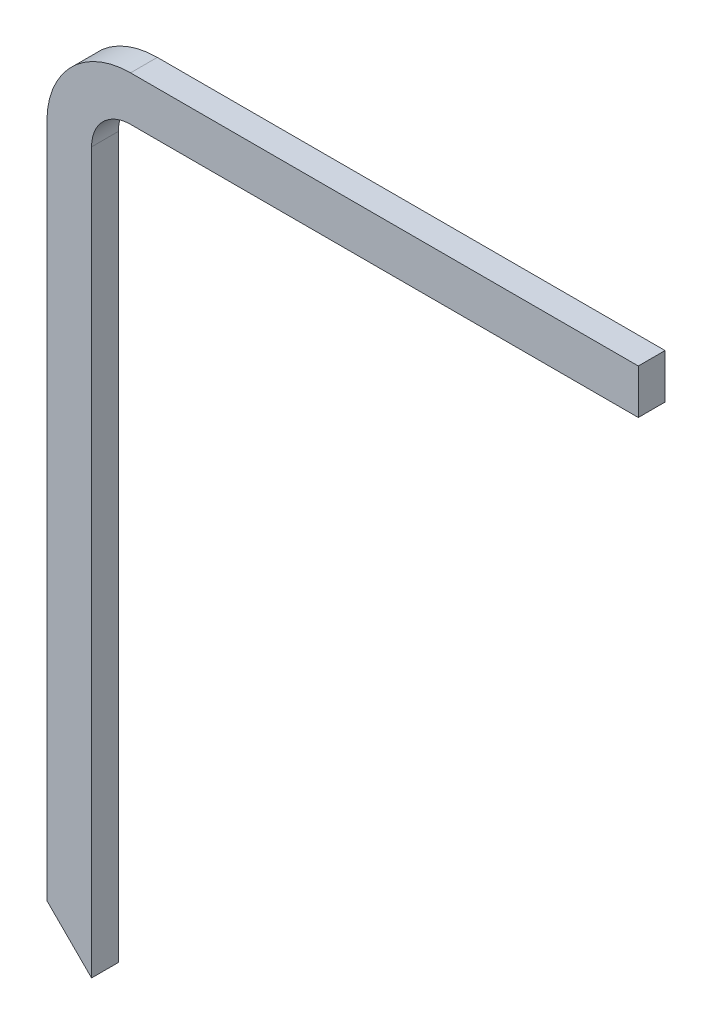
from build123d import *

# Parameters (mm, degrees)
SALIENTE_EXTRUIR1_DEPTH = 6


with BuildPart() as part:
    # Croquis1 → Saliente-Extruir1 (new body)
    with BuildSketch(Plane.XY):
        with BuildLine():
            Line((122.5, 180), (8.736, 180))
            ThreePointArc((8.736, 180), (-4.512352652, 174.512352652), (-10, 161.264))
            Line((-10, 161.264), (-10, 10))
            Line((-10, 10), (0, 0))
            Line((0, 0), (0, 161.264))
            ThreePointArc((0, 161.264), (2.55871516, 167.44128484), (8.736, 170))
            Line((8.736, 170), (122.5, 170))
            Line((122.5, 170), (122.5, 180))
        make_face()
    extrude(amount=SALIENTE_EXTRUIR1_DEPTH)


solid = part.part
